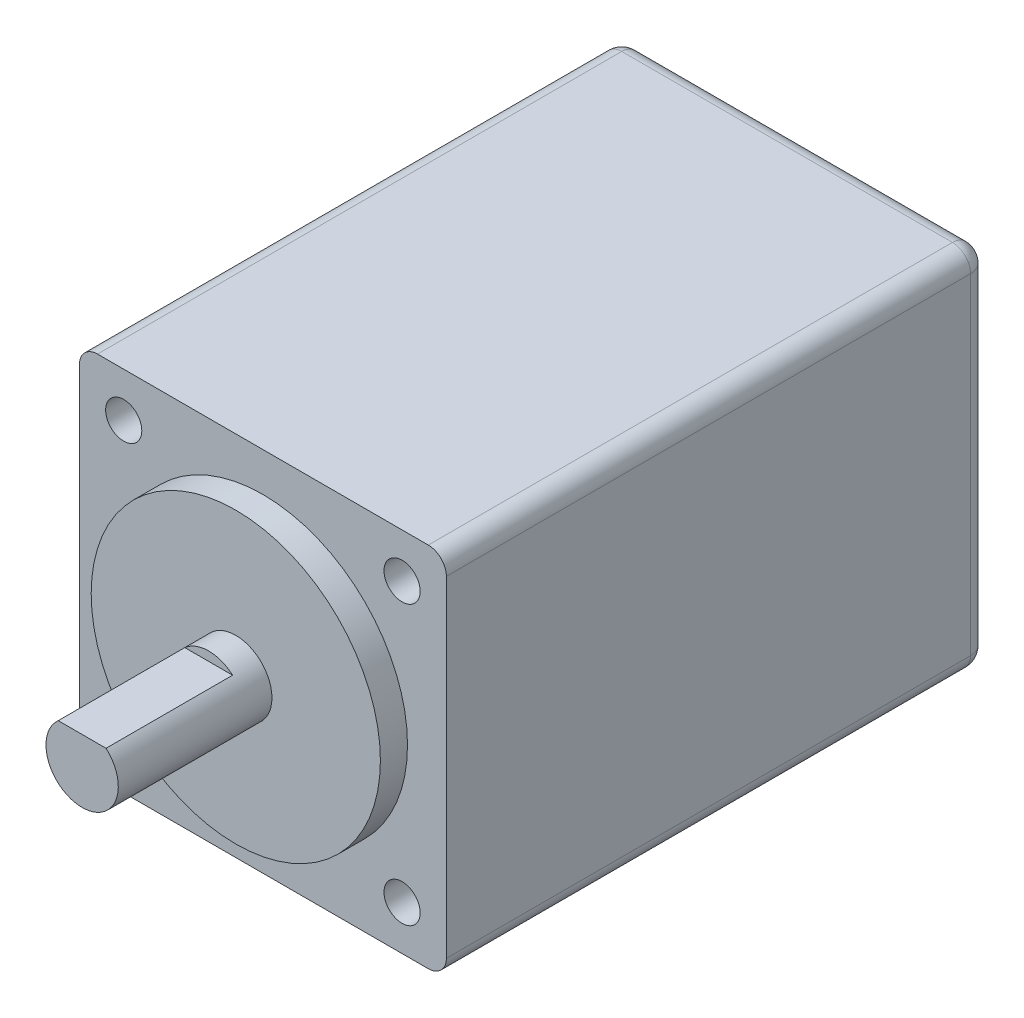
from build123d import *

# Parameters (mm, degrees)
SKETCH1_W           = 20.3
SKETCH1_H           = 20.3
BOSS_EXTRUDE1_DEPTH = 30
SKETCH2_R           = 8
BOSS_EXTRUDE2_DEPTH = 1.5
SKETCH3_R           = 2
BOSS_EXTRUDE3_DEPTH = 8.5
SKETCH4_W           = 7
SKETCH4_H           = 0.5
CUT_EXTRUDE1_DEPTH  = 5
SKETCH5_R           = 1
CUT_EXTRUDE2_DEPTH  = 2.5
FILLET1_R           = 1


with BuildPart() as part:
    # Sketch1 → Boss-Extrude1 (new body)
    with BuildSketch(Plane.XY):
        Rectangle(SKETCH1_W, SKETCH1_H)
    extrude(amount=BOSS_EXTRUDE1_DEPTH)

    # Sketch2 → Boss-Extrude2 (add)
    with BuildSketch(Plane.XY.offset(30)):
        with Locations(Location((0, 0, 0), (0, 0, 180))):
            Circle(SKETCH2_R)
    extrude(amount=BOSS_EXTRUDE2_DEPTH)

    # Sketch3 → Boss-Extrude3 (add)
    with BuildSketch(Plane.XY.offset(31.5)):
        Circle(SKETCH3_R)
    extrude(amount=BOSS_EXTRUDE3_DEPTH)

    # Sketch4 → Cut-Extrude1 (cut, symmetric)
    with BuildSketch(Plane(origin=(0, 0, 0), x_dir=(0, 0, -1), z_dir=(1, 0, 0))):
        with Locations((-36.5, 1.75)):
            Rectangle(SKETCH4_W, SKETCH4_H)
    extrude(amount=CUT_EXTRUDE1_DEPTH, both=True, mode=Mode.SUBTRACT)

    # Sketch5 → Cut-Extrude2 (cut)
    with BuildSketch(Plane.XY.offset(30)):
        with Locations((-7.7, 7.7)):
            Circle(SKETCH5_R)
        with Locations((7.7, 7.7)):
            Circle(SKETCH5_R)
        with Locations((7.7, -7.7)):
            Circle(SKETCH5_R)
        with Locations((-7.7, -7.7)):
            Circle(SKETCH5_R)
    extrude(amount=-CUT_EXTRUDE2_DEPTH, mode=Mode.SUBTRACT)

    # Fillet1
    fillet1_edges = [part.edges().sort_by_distance(p)[0] for p in [
        (0, -10.15, 0),
        (-10.15, 0, 0),
        (0, 10.15, 0),
        (10.15, 0, 0),
        (10.15, -10.15, 15),
        (-10.15, -10.15, 15),
        (-10.15, 10.15, 15),
        (10.15, 10.15, 15),
    ]]
    fillet(fillet1_edges, radius=FILLET1_R)


solid = part.part
